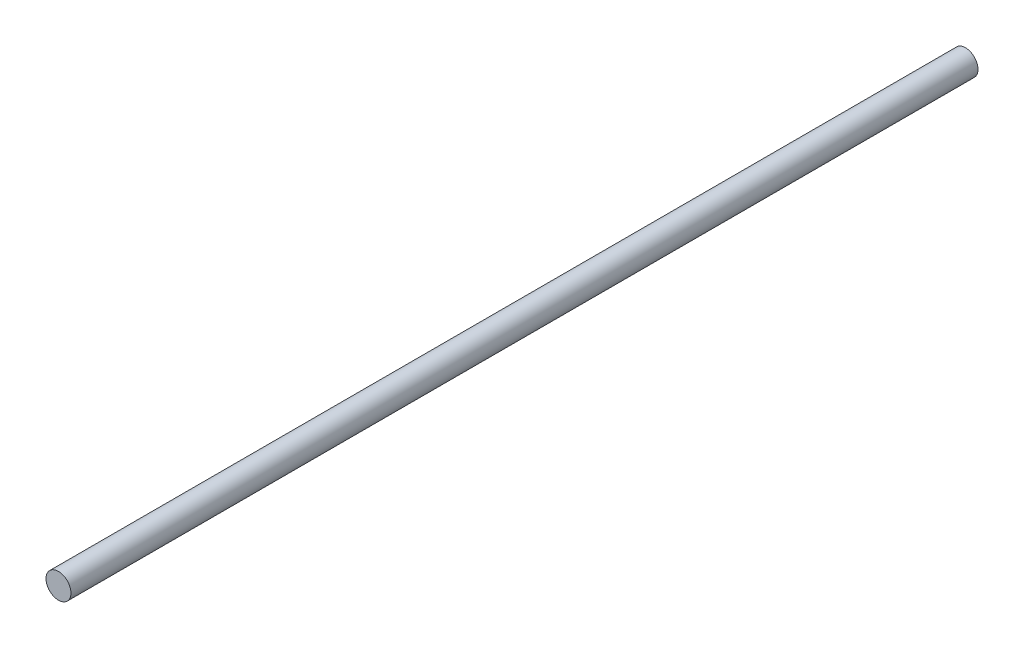
from build123d import *

# Parameters (mm, degrees)
IZIM1_R                     = 6
Y_KSEKLIK_EKSTR_ZYON1_DEPTH = 218


with BuildPart() as part:
    # Çizim1 → Yükseklik-Ekstrüzyon1 (new, symmetric)
    with BuildSketch(Plane.XY):
        Circle(IZIM1_R)
    extrude(amount=Y_KSEKLIK_EKSTR_ZYON1_DEPTH, both=True)


solid = part.part
